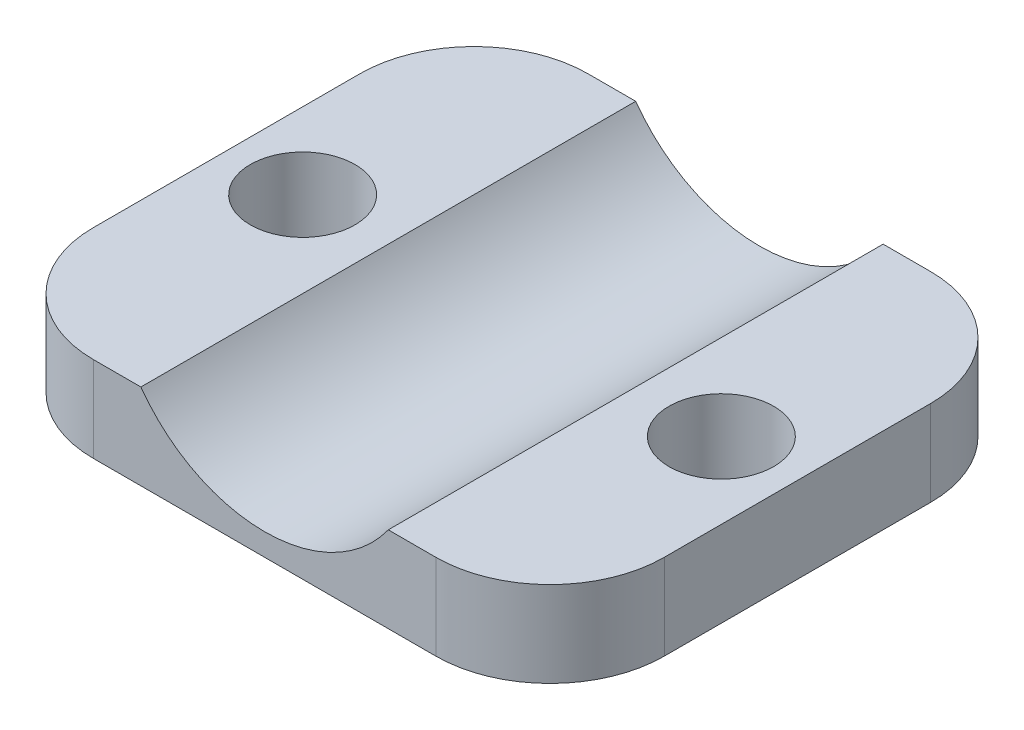
from build123d import *

# Parameters (mm, degrees)
SKETCH1_W                      = 30
SKETCH1_H                      = 26
BOSS_EXTRUDE1_DEPTH            = 4.5
CUT_EXTRUDE1_DEPTH             = 40.953097502
F_5_5_5_5_DIAMETER_HOLE1_D     = 5.5
F_5_5_5_5_DIAMETER_HOLE1_DEPTH = 10
F_5_5_5_5_DIAMETER_HOLE1_TIP   = 1.652366702
FILLET2_R                      = 6


with BuildPart() as part:
    # Sketch1 → Boss-Extrude1 (new body)
    with BuildSketch(Plane(origin=(0, 0, 0), x_dir=(1, 0, 0), z_dir=(0, 1, 0))):
        with Locations((15, 13)):
            Rectangle(SKETCH1_W, SKETCH1_H)
    extrude(amount=BOSS_EXTRUDE1_DEPTH)

    # Sketch2 → Cut-Extrude1 (cut, through all)
    with BuildSketch(Plane.XY):
        with BuildLine():
            Line((8.5, 4.5), (21.5, 4.5))
            ThreePointArc((21.5, 4.5), (15, 1.163689527), (8.5, 4.5))
        make_face()
    extrude(amount=-CUT_EXTRUDE1_DEPTH, mode=Mode.SUBTRACT)

    # Ø5.5 (5.5) Diameter Hole1
    with Locations(Plane(origin=(0, 4.5, 0), x_dir=(-1, 0, 0), z_dir=(0, 1, 0))):
        with Locations((-4, -13), (-26, -13)):
            Hole(F_5_5_5_5_DIAMETER_HOLE1_D / 2, depth=F_5_5_5_5_DIAMETER_HOLE1_DEPTH)
            with Locations((0, 0, -(F_5_5_5_5_DIAMETER_HOLE1_DEPTH + F_5_5_5_5_DIAMETER_HOLE1_TIP / 2))):  # 118° drill point
                Cone(0, F_5_5_5_5_DIAMETER_HOLE1_D / 2, F_5_5_5_5_DIAMETER_HOLE1_TIP, mode=Mode.SUBTRACT)

    # Fillet2
    fillet2_edges = [part.edges().sort_by_distance(p)[0] for p in [
        (0, 2.25, 0),
        (0, 2.25, -26),
        (30, 2.25, -26),
        (30, 2.25, 0),
    ]]
    fillet(fillet2_edges, radius=FILLET2_R)


solid = part.part
